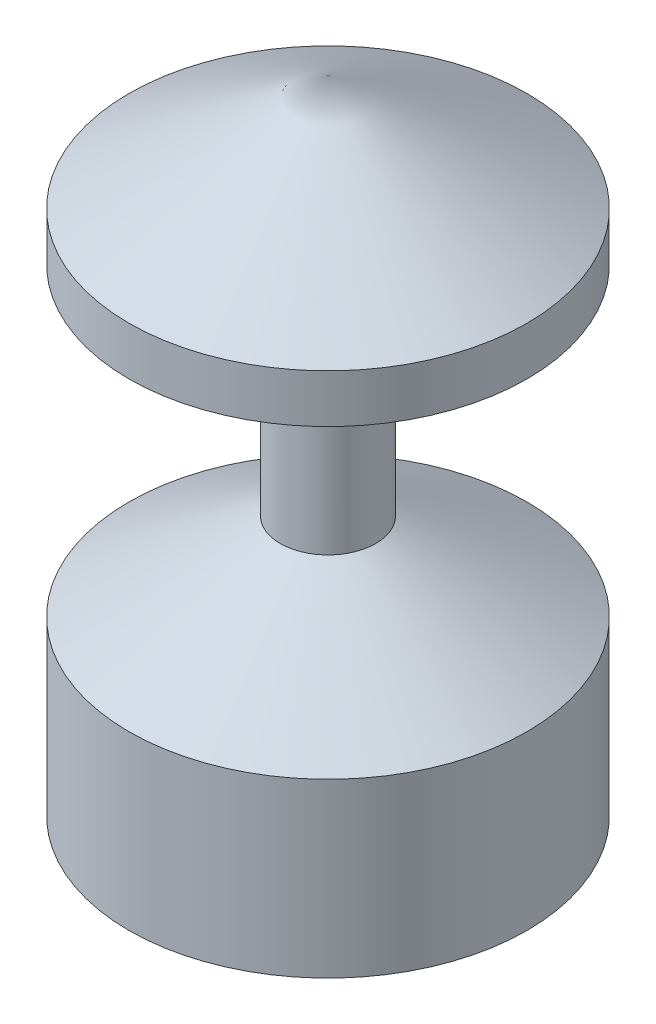
from build123d import *


with BuildPart() as part:
    # Sketch1 → Revolve1 (revolve)
    with BuildSketch(Plane(origin=(0, 0, 0), x_dir=(0, 0, -1), z_dir=(1, 0, 0))):
        Polygon((0, 5.484827557), (-9.5, 0), (-9.5, -1), (-12.5, -1), (-12.5, 9.814954576), (-3, 15.299782134), (-3, 29), (-12.5, 29), (-12.5, 32.033121635), (0, 39.25), align=None)
    revolve(axis=Axis((0, 39.25, 0), (0, -1, 0)))


solid = part.part
